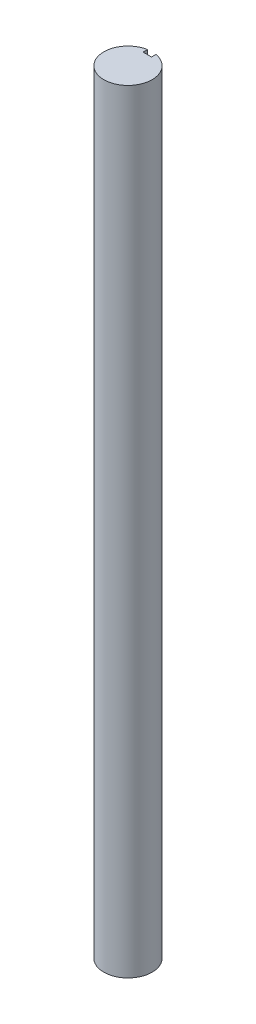
from build123d import *

# Parameters (mm, degrees)
SKETCH1_R           = 10
BOSS_EXTRUDE1_DEPTH = 160
CUT_EXTRUDE1_DEPTH  = 40


with BuildPart() as part:
    # Sketch1 → Boss-Extrude1 (new, symmetric)
    with BuildSketch(Plane(origin=(0, 0, 0), x_dir=(1, 0, 0), z_dir=(0, 1, 0))):
        with Locations(Location((0, 0, 0), (0, 0, 270))):
            Circle(SKETCH1_R)
    extrude(amount=BOSS_EXTRUDE1_DEPTH, both=True)

    # Sketch2 → Cut-Extrude1 (cut)
    with BuildSketch(Plane(origin=(0, 160, 0), x_dir=(1, 0, 0), z_dir=(0, 1, 0))):
        Polygon((-1.75, 9.845684334), (-1.75, 8), (1.75, 8), (1.75, 9.845684334), (1.75, 11.147310955), (-1.75, 11.147310955), align=None)
    extrude(amount=-CUT_EXTRUDE1_DEPTH, mode=Mode.SUBTRACT)


solid = part.part
